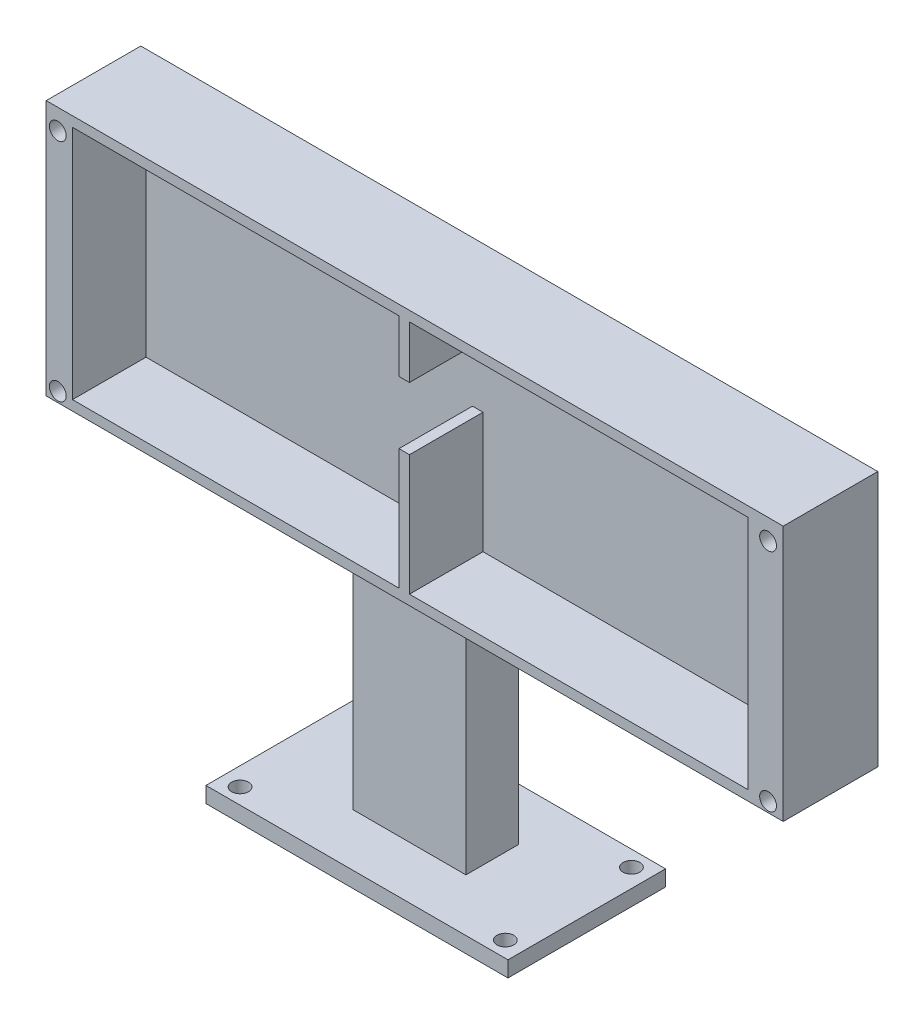
from build123d import *

# Parameters (mm, degrees)
SKETCH_1_W               = 126.3
SKETCH_1_H               = 42.9
SKETCH_1_W_2             = 2
SKETCH_1_W_3             = 62.15
EXTRUDE_6_DEPTH          = 15
SKETCH_2_W               = 62.15
SKETCH_2_H               = 42.9
CUT_EXTRUDE_1_DEPTH      = 23
SKETCH_4_W               = 10
SKETCH_4_H               = 40
CUT_EXTRUDE_2_DEPTH      = 159.899905601
CUT_EXTRUDE_3_DEPTH      = 119.456321064
CUT_EXTRUDE_3_DEPTH_BACK = 119.456321064
SKETCH_5_W               = 10
SKETCH_5_H               = 40
CUT_EXTRUDE_4_DEPTH      = 159.899905601
CUT_EXTRUDE_4_DEPTH_BACK = 159.899905601
SKETCH_6_W               = 9
SKETCH_6_H               = 46.7
SKETCH_7_W               = 14
SKETCH_7_H               = 11.9
CUT_EXTRUDE_5_DEPTH      = 23
SKETCH_9_R               = 1.6
CUT_EXTRUDE_6_DEPTH      = 10
CUT_EXTRUDE_7_DEPTH      = 159.899905601
CUT_EXTRUDE_7_DEPTH_BACK = 159.899905601
SKETCH_11_W              = 3
SKETCH_11_H              = 46.7
SKETCH_14_W              = 7
SKETCH_14_H              = 18
EXTRUDE_8_DEPTH          = 46.7
SKETCH_15_W              = 2.315581883
SKETCH_15_H              = 42.9
SKETCH_15_R              = 1.6
CUT_EXTRUDE_9_DEPTH      = 14
SKETCH_19_W              = 3
SKETCH_19_H              = 18
EXTRUDE_9_DEPTH          = 46.7
SKETCH_20_W              = 140.3
SKETCH_20_H              = 2
EXTRUDE_10_DEPTH         = 18
SKETCH_21_R              = 1.6
CUT_EXTRUDE_13_DEPTH     = 14
SKETCH_23_W              = 2
SKETCH_23_H              = 2
EXTRUDE_11_DEPTH         = 14


with BuildPart() as part:
    # 草图1 → 凸台-拉伸6 (new, symmetric)
    # profile 1 of 4: a face of its own
    with BuildSketch(Plane.XY):
        Polygon((-39.5, 0), (-39.5, 3), (-21.5, 3), (-21.5, 43), (-75.9, 43), (-75.9, 89.7), (54.4, 89.7), (54.4, 43), (0, 43), (0, 3), (18, 3), (18, 0), align=None)
        with Locations((-10.75, 66.35)):
            Rectangle(SKETCH_1_W, SKETCH_1_H, mode=Mode.SUBTRACT)
    # profile 2 of 4: a face of its own
    with BuildSketch(Plane.XY):
        with Locations((-10.75, 66.35)):
            Rectangle(SKETCH_1_W_2, SKETCH_1_H)
    # profile 3 of 4: a face of its own
    with BuildSketch(Plane.XY):
        with Locations((21.325, 66.35)):
            Rectangle(SKETCH_1_W_3, SKETCH_1_H)
    # profile 4 of 4: a face of its own
    with BuildSketch(Plane.XY):
        with Locations((-42.825, 66.35)):
            Rectangle(SKETCH_1_W_3, SKETCH_1_H)
    extrude(amount=EXTRUDE_6_DEPTH, both=True)

    # 草图2 → 切除-拉伸1 (cut)
    with BuildSketch(Plane.XY.offset(15)):
        with Locations((-42.825, 66.35)):
            Rectangle(SKETCH_2_W, SKETCH_2_H)
        with Locations((21.325, 66.35)):
            Rectangle(SKETCH_2_W, SKETCH_2_H)
    extrude(amount=-CUT_EXTRUDE_1_DEPTH, mode=Mode.SUBTRACT)

    # 草图4 → 切除-拉伸2 (cut, through all)
    with BuildSketch(Plane.ZY.offset(75.9)):
        with Locations((10, 23)):
            Rectangle(SKETCH_4_W, SKETCH_4_H)
    extrude(amount=-CUT_EXTRUDE_2_DEPTH, mode=Mode.SUBTRACT)

    # 草图5 → 切除-拉伸3 (cut, two sides: drawn at the far end of the back side and taken through both)
    with BuildSketch(Plane.ZY.offset(21.5).offset(-CUT_EXTRUDE_3_DEPTH_BACK)):
        with Locations((-10, 23)):
            Rectangle(SKETCH_5_W, SKETCH_5_H)
    extrude(amount=CUT_EXTRUDE_3_DEPTH + CUT_EXTRUDE_3_DEPTH_BACK, mode=Mode.SUBTRACT)

    # 草图6 → 切除-拉伸4 (cut, two sides: drawn at the far end of the back side and taken through both)
    with BuildSketch(Plane.ZY.offset(75.9).offset(-CUT_EXTRUDE_4_DEPTH_BACK)):
        with Locations((10.5, 66.35)):
            Rectangle(SKETCH_6_W, SKETCH_6_H)
    extrude(amount=CUT_EXTRUDE_4_DEPTH + CUT_EXTRUDE_4_DEPTH_BACK, mode=Mode.SUBTRACT)

    # 草图7 → 切除-拉伸5 (cut)
    with BuildSketch(Plane.ZY.offset(11.75)):
        with Locations((-1, 73.85)):
            Rectangle(SKETCH_7_W, SKETCH_7_H)
    extrude(amount=-CUT_EXTRUDE_5_DEPTH, mode=Mode.SUBTRACT)

    # 草图9 → 切除-拉伸6 (cut)
    with BuildSketch(Plane.XZ):
        with Locations(Location((-36, 12, 0), (0, 0, 270))):
            Circle(SKETCH_9_R)
        with Locations(Location((-36, -12, 0), (0, 0, 270))):
            Circle(SKETCH_9_R)
        with Locations(Location((14.5, 12, 0), (0, 0, 270))):
            Circle(SKETCH_9_R)
        with Locations(Location((14.5, -12, 0), (0, 0, 270))):
            Circle(SKETCH_9_R)
    extrude(amount=-CUT_EXTRUDE_6_DEPTH, mode=Mode.SUBTRACT)

    # 草图11 → 切除-拉伸7 (cut, two sides: drawn at the far end of the back side and taken through both)
    with BuildSketch(Plane.ZY.offset(75.9).offset(-CUT_EXTRUDE_7_DEPTH_BACK)):
        with Locations((-13.5, 66.35)):
            Rectangle(SKETCH_11_W, SKETCH_11_H)
    extrude(amount=CUT_EXTRUDE_7_DEPTH + CUT_EXTRUDE_7_DEPTH_BACK, mode=Mode.SUBTRACT)

    # 草图14 → 凸台-拉伸8 (add)
    with BuildSketch(Plane(origin=(0, 89.7, 0), x_dir=(1, 0, 0), z_dir=(0, 1, 0))):
        with Locations((57.9, 3)):
            Rectangle(SKETCH_14_W, SKETCH_14_H)
    extrude(amount=-EXTRUDE_8_DEPTH)

    # 草图15 → 切除-拉伸9 (cut)
    with BuildSketch(Plane.XY.offset(6)):
        with BuildLine():
            ThreePointArc((60.11573898, 44.9), (58.51573898, 46.5), (56.91573898, 44.9))
            ThreePointArc((56.91573898, 44.9), (58.51573898, 43.3), (60.11573898, 44.9))
        make_face()
        with Locations((53.557790942, 66.35)):
            Rectangle(SKETCH_15_W, SKETCH_15_H)
        Polygon((52.4, 44.9), (52.4, 87.8), (-9.75, 87.8), (-9.75, 79.8), (-11.75, 79.8), (-11.75, 87.8), (-73.9, 87.8), (-73.9, 44.9), (-11.75, 44.9), (-11.75, 67.9), (-9.75, 67.9), (-9.75, 44.9), align=None)
        with Locations((58.51385679, 87.8)):
            Circle(SKETCH_15_R)
    extrude(amount=-CUT_EXTRUDE_9_DEPTH, mode=Mode.SUBTRACT)

    # 草图19 → 凸台-拉伸9 (add)
    with BuildSketch(Plane(origin=(0, 89.7, 0), x_dir=(1, 0, 0), z_dir=(0, 1, 0))):
        with Locations((-77.4, 3)):
            Rectangle(SKETCH_19_W, SKETCH_19_H)
    extrude(amount=-EXTRUDE_9_DEPTH)

    # 草图20 → 凸台-拉伸10 (add)
    with BuildSketch(Plane.XY.offset(6)):
        with Locations((-8.75, 90.7)):
            Rectangle(SKETCH_20_W, SKETCH_20_H)
    extrude(amount=-EXTRUDE_10_DEPTH)

    # 草图21 → 切除-拉伸13 (cut)
    with BuildSketch(Plane.XY.offset(6)):
        with Locations((-76.7, 44.9)):
            Circle(SKETCH_21_R)
        Polygon((-73.9, 89.8), (-73.9, 87.8), (-11.75, 87.8), (54.715581883, 87.8), (54.715581883, 89.8), align=None)
        with Locations((-76.7, 87.8)):
            Circle(SKETCH_21_R)
    extrude(amount=-CUT_EXTRUDE_13_DEPTH, mode=Mode.SUBTRACT)

    # 草图23 → 凸台-拉伸11 (add)
    with BuildSketch(Plane.XY.offset(-8)):
        with Locations((-10.75, 88.8)):
            Rectangle(SKETCH_23_W, SKETCH_23_H)
    extrude(amount=EXTRUDE_11_DEPTH)


solid = part.part
